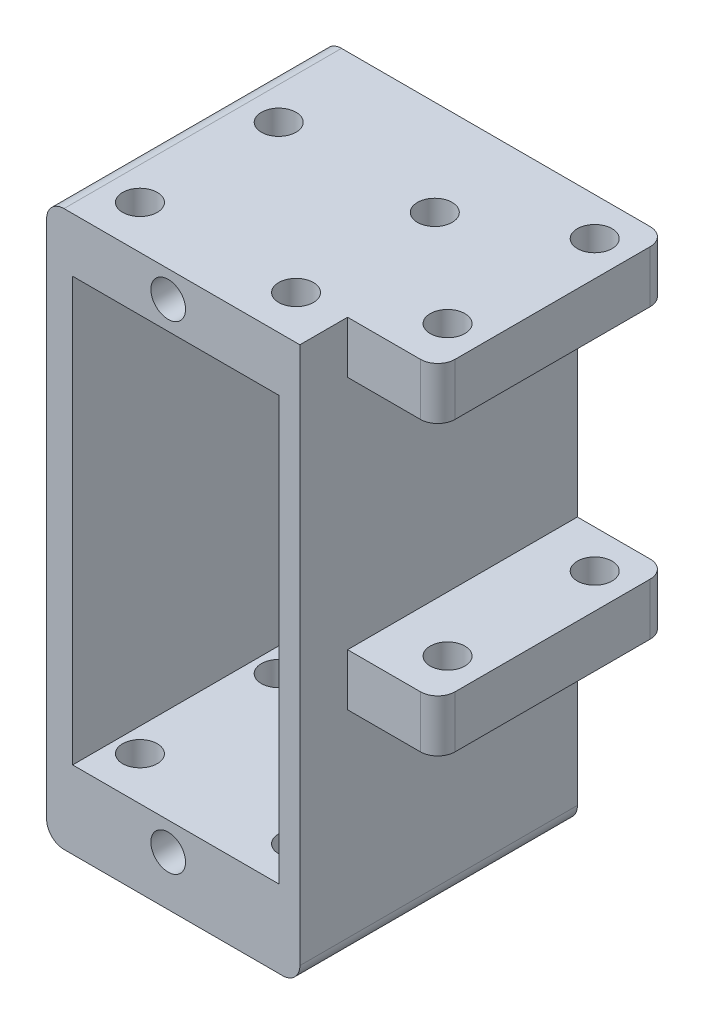
from build123d import *

# Parameters (mm, degrees)
SKETCH2_W           = 14.6
SKETCH2_H           = 32
BOSS_EXTRUDE1_DEPTH = 16
FILLET1_R           = 1
SKETCH3_W           = 11.9
SKETCH3_H           = 24.4
CUT_EXTRUDE1_DEPTH  = 16
SKETCH4_R           = 1
CUT_EXTRUDE2_DEPTH  = 16
SKETCH5_R           = 1
CUT_EXTRUDE3_DEPTH  = 113.555199241
SKETCH6_W           = 5.2
SKETCH6_H           = 13.25
BOSS_EXTRUDE2_DEPTH = 3
SKETCH7_W           = 5.2
SKETCH7_H           = 13.25
BOSS_EXTRUDE3_DEPTH = 3
SKETCH8_R           = 1
CUT_EXTRUDE4_DEPTH  = 33
FILLET2_R           = 1


with BuildPart() as part:
    # Sketch2 → Boss-Extrude1 (new body)
    with BuildSketch(Plane.XY):
        with Locations((-99.41772522, 219.327818509)):
            Rectangle(SKETCH2_W, SKETCH2_H)
    extrude(amount=BOSS_EXTRUDE1_DEPTH)

    # Fillet1
    fillet1_edges = [part.edges().sort_by_distance(p)[0] for p in [
        (-106.71772522, 235.327818509, 8),
        (-92.11772522, 203.327818509, 8),
        (-106.71772522, 203.327818509, 8),
    ]]
    fillet(fillet1_edges, radius=FILLET1_R)

    # Sketch3 → Cut-Extrude1 (cut)
    with BuildSketch(Plane.XY.offset(16)):
        with Locations((-99.26772522, 219.999996948)):
            Rectangle(SKETCH3_W, SKETCH3_H)
    extrude(amount=-CUT_EXTRUDE1_DEPTH, mode=Mode.SUBTRACT)

    # Sketch4 → Cut-Extrude2 (cut)
    with BuildSketch(Plane.XY.offset(16)):
        with Locations((-99.709122305, 233.799996948)):
            Circle(SKETCH4_R)
        with Locations((-99.709122305, 206.199996948)):
            Circle(SKETCH4_R)
    extrude(amount=-CUT_EXTRUDE2_DEPTH, mode=Mode.SUBTRACT)

    # Sketch5 → Cut-Extrude3 (cut, through all)
    with BuildSketch(Plane(origin=(0, 235.327818509, 0), x_dir=(1, 0, 0), z_dir=(0, 1, 0))):
        with Locations(Location((-103.837557169, -5.5, 0), (0, 0, 270))):
            Circle(SKETCH5_R)
        with Locations(Location((-94.837557169, -5.5, 0), (0, 0, 270))):
            Circle(SKETCH5_R)
        with Locations(Location((-94.837557169, -13.5, 0), (0, 0, 270))):
            Circle(SKETCH5_R)
        with Locations(Location((-103.837557169, -13.5, 0), (0, 0, 270))):
            Circle(SKETCH5_R)
    extrude(amount=-CUT_EXTRUDE3_DEPTH, mode=Mode.SUBTRACT)

    # Sketch6 → Boss-Extrude2 (add)
    with BuildSketch(Plane(origin=(0, 235.327818509, 0), x_dir=(1, 0, 0), z_dir=(0, 1, 0))):
        with Locations((-89.51772522, -6.625)):
            Rectangle(SKETCH6_W, SKETCH6_H)
    extrude(amount=-BOSS_EXTRUDE2_DEPTH)

    # Sketch7 → Boss-Extrude3 (add)
    with BuildSketch(Plane(origin=(0, 218.727818509, 0), x_dir=(1, 0, 0), z_dir=(0, 1, 0))):
        with Locations((-89.51772522, -6.625)):
            Rectangle(SKETCH7_W, SKETCH7_H)
    extrude(amount=-BOSS_EXTRUDE3_DEPTH)

    # Sketch8 → Cut-Extrude4 (cut)
    with BuildSketch(Plane(origin=(0, 235.327818509, 0), x_dir=(1, 0, 0), z_dir=(0, 1, 0))):
        with Locations(Location((-88.91772522, -2.2, 0), (0, 0, 270))):
            Circle(SKETCH8_R)
        with Locations(Location((-88.91772522, -10.684490828, 0), (0, 0, 270))):
            Circle(SKETCH8_R)
    extrude(amount=-CUT_EXTRUDE4_DEPTH, mode=Mode.SUBTRACT)

    # Fillet2
    fillet2_edges = [part.edges().sort_by_distance(p)[0] for p in [
        (-86.91772522, 217.227818509, 0),
        (-86.91772522, 217.227818509, 13.25),
        (-86.91772522, 233.827818509, 0),
        (-86.91772522, 233.827818509, 13.25),
    ]]
    fillet(fillet2_edges, radius=FILLET2_R)


solid = part.part
